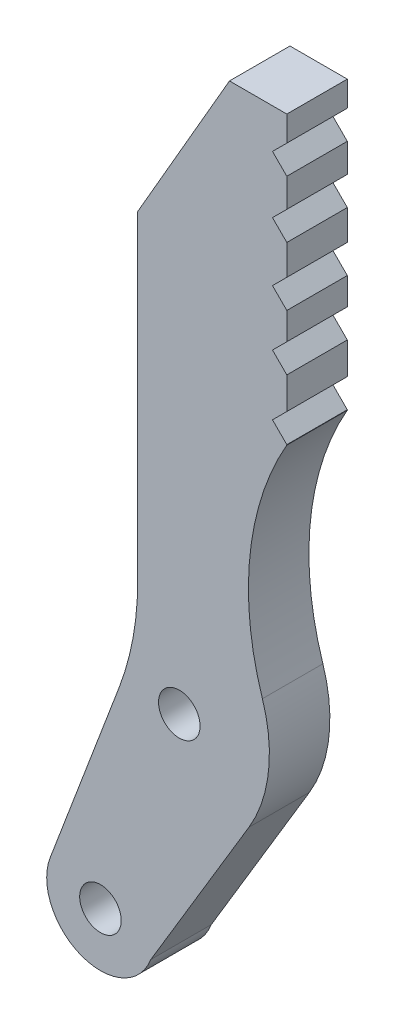
from build123d import *

# Parameters (mm, degrees)
BOSS_EXTRUDE1_DEPTH      = 5.08
BOSS_EXTRUDE1_DEPTH_BACK = 0.278409343
SKETCH1_R                = 1.8415
CUT_EXTRUDE1_DEPTH       = 72.358313291
CUT_EXTRUDE1_DEPTH_BACK  = 72.358313291
BOSS_EXTRUDE2_DEPTH      = 0.635
FILLET2_R                = 12.7
CUT_EXTRUDE2_DEPTH       = 72.358313411
CUT_EXTRUDE2_DEPTH_BACK  = 72.358313411
FILLET3_R                = 25.4


with BuildPart() as part:
    # Sketch1 → Boss-Extrude1 (new, two sides: drawn at the far end of the back side and taken through both)
    with BuildSketch(Plane.XY.offset(-BOSS_EXTRUDE1_DEPTH_BACK)):
        with BuildLine():
            Line((-1.208443772, 47.324573258), (-1.208443772, 10.242675014))
            Line((-1.208443772, 10.242675014), (-4.452925719, 1.68904079))
            ThreePointArc((-4.452925719, 1.68904079), (-1.68904079, -4.452925719), (4.452925719, -1.68904079))
            Line((4.452925719, -1.68904079), (16.51, 18.415))
            ThreePointArc((16.51, 18.415), (13.107045256, 31.115), (16.51, 43.815))
            Line((16.51, 43.815), (16.51, 69.215))
            Line((16.51, 69.215), (11.43, 69.215))
            Line((11.43, 69.215), (-1.208443772, 47.324573258))
        make_face()
        Circle(SKETCH1_R, mode=Mode.SUBTRACT)
        with Locations((6.985, 18.415)):
            Circle(SKETCH1_R, mode=Mode.SUBTRACT)
    extrude(amount=BOSS_EXTRUDE1_DEPTH + BOSS_EXTRUDE1_DEPTH_BACK)

    # Sketch2 → Cut-Extrude1 (cut, two sides: drawn at the far end of the back side and taken through both)
    with BuildSketch(Plane(origin=(0, 0, -0.278409343), x_dir=(-1, 0, 0), z_dir=(0, 0, -1)).offset(-CUT_EXTRUDE1_DEPTH_BACK)):
        Polygon((-16.51, 64.442139164), (-15.24, 65.712139164), (-16.51, 66.982139164), align=None)
        Polygon((-16.51, 61.902139164), (-16.51, 59.362139164), (-15.24, 60.632139164), align=None)
        Polygon((-15.24, 55.415909985), (-16.51, 56.685909985), (-16.51, 54.145909985), align=None)
        Polygon((-16.51, 49.202139164), (-15.24, 50.472139164), (-16.51, 51.742139164), align=None)
        Polygon((-16.51, 43.849680806), (-15.24, 45.119680806), (-16.51, 46.389680806), align=None)
    extrude(amount=CUT_EXTRUDE1_DEPTH + CUT_EXTRUDE1_DEPTH_BACK, mode=Mode.SUBTRACT)

    # Sketch5 → Boss-Extrude2 (add)
    # profile 1 of 5: a face of its own
    with BuildSketch(Plane(origin=(0, 0, -0.278409343), x_dir=(-1, 0, 0), z_dir=(0, 0, -1))):
        Polygon((-11.43, 49.268745692), (-11.43, 50.883373857), (-9.418496835, 52.375422908), (-9.795276899, 52.676846958), (-11.43, 52.676846958), (-11.43, 53.962922908), (-6.35, 53.962922908), (-6.35, 52.676846958), (-8.660917722, 52.676846958), (-6.35, 50.897440313), (-6.35, 49.397353287), (-8.701107595, 51.338524173), align=None)
    # profile 2 of 5: a face of its own
    with BuildSketch(Plane(origin=(0, 0, -0.278409343), x_dir=(-1, 0, 0), z_dir=(0, 0, -1))):
        Polygon((-11.43, 43.931530503), (-11.43, 45.303009933), (-10.401139241, 45.658690313), (-10.401139241, 47.54560487), (-11.43, 47.901285249), (-11.43, 49.204441895), (-6.35, 47.323555819), (-6.35, 45.812416579), align=None)
        Polygon((-9.500886076, 45.963128604), (-7.647128165, 46.602147591), (-9.500886076, 47.241166579), align=None, mode=Mode.SUBTRACT)
    # profile 3 of 5: a face of its own
    with BuildSketch(Plane(origin=(0, 0, -0.278409343), x_dir=(-1, 0, 0), z_dir=(0, 0, -1))):
        with BuildLine():
            add(Edge.make_bspline(
                [(-7.945537975, 39.044441895), (-8.001893228, 39.045595729), (-8.114416057, 39.047899554), (-8.28200483, 39.072775037), (-8.447950006, 39.109194211), (-8.609957002, 39.161582728), (-8.764806034, 39.226372615), (-8.907675176, 39.307175215), (-9.039325299, 39.398356472), (-9.116222705, 39.470801449), (-9.154248418, 39.506625439)],
                knots=[0, 0, 0, 0, 1.018976149, 2.03455883, 3.059303171, 4.090371279, 5.111291766, 6.090739543, 7.055872052, 8, 8, 8, 8], degree=3))
            add(Edge.make_bspline(
                [(-9.154248418, 39.506625439), (-9.201805939, 39.55801623), (-9.296070219, 39.659878477), (-9.418570971, 39.826256442), (-9.522735706, 40.00129059), (-9.610286921, 40.186696086), (-9.676976835, 40.389424255), (-9.724895215, 40.612612286), (-9.752324851, 40.858668471), (-9.756124843, 41.030087139), (-9.758101266, 41.11924411)],
                knots=[0, 0, 0, 0, 0.948117162, 1.879273337, 2.792894651, 3.704383692, 4.651446974, 5.677657949, 6.792121143, 8, 8, 8, 8], degree=3))
            Line((-9.758101266, 41.11924411), (-9.758101266, 41.938112781))
            Line((-9.758101266, 41.938112781), (-11.43, 41.938112781))
            Line((-11.43, 41.938112781), (-11.43, 43.22418873))
            Line((-11.43, 43.22418873), (-6.35, 43.22418873))
            Line((-6.35, 43.22418873), (-6.35, 41.075035249))
            add(Edge.make_bspline(
                [(-6.35, 41.075035249), (-6.350776756, 40.997637205), (-6.35226824, 40.849021858), (-6.368729674, 40.63535844), (-6.394065089, 40.440645282), (-6.429937183, 40.263077028), (-6.478568776, 40.100769403), (-6.533724195, 39.948050161), (-6.602528473, 39.805953028), (-6.656105267, 39.717237318), (-6.682571203, 39.673413414)],
                knots=[0, 0, 0, 0, 1.27106079, 2.440619017, 3.517381815, 4.494852357, 5.412224011, 6.298180721, 7.159333057, 8, 8, 8, 8], degree=3))
            add(Edge.make_bspline(
                [(-6.682571203, 39.673413414), (-6.716741123, 39.624441403), (-6.784307056, 39.527606537), (-6.908159272, 39.40226874), (-7.043131438, 39.291772761), (-7.194439682, 39.202199788), (-7.360207545, 39.131182806), (-7.541414973, 39.079940069), (-7.738556134, 39.049817137), (-7.875098439, 39.046271184), (-7.945537975, 39.044441895)],
                knots=[0, 0, 0, 0, 0.969589194, 1.917218374, 2.854679868, 3.800052037, 4.766330684, 5.780154268, 6.854824506, 8, 8, 8, 8], degree=3))
        make_face()
        with BuildLine():
            add(Edge.make_bspline(
                [(-7.980704114, 40.394821642), (-7.94708576, 40.396040367), (-7.881091423, 40.398432779), (-7.786293373, 40.42106559), (-7.698560794, 40.457900068), (-7.620028501, 40.509101182), (-7.551714372, 40.570364624), (-7.492559182, 40.636019652), (-7.443946978, 40.706545052), (-7.421922651, 40.758113612), (-7.411012658, 40.783658667)],
                knots=[0, 0, 0, 0, 1.099448196, 2.158266167, 3.170681306, 4.20198982, 5.212085426, 6.167530276, 7.092265935, 8, 8, 8, 8], degree=3))
            add(Edge.make_bspline(
                [(-7.411012658, 40.783658667), (-7.398681248, 40.817631613), (-7.374423802, 40.884460703), (-7.349009707, 40.986535287), (-7.329727426, 41.086742841), (-7.322884819, 41.189157588), (-7.319312234, 41.298731496), (-7.315930195, 41.421655598), (-7.315672903, 41.560999172), (-7.314943057, 41.659128638), (-7.314556962, 41.711039996)],
                knots=[0, 0, 0, 0, 0.923484003, 1.816610051, 2.686736138, 3.528764097, 4.437155579, 5.490796045, 6.672608819, 8, 8, 8, 8], degree=3))
            Line((-7.314556962, 41.711039996), (-7.314556962, 41.938112781))
            Line((-7.314556962, 41.938112781), (-8.793544304, 41.938112781))
            Line((-8.793544304, 41.938112781), (-8.793544304, 41.559323224))
            add(Edge.make_bspline(
                [(-8.793544304, 41.559323224), (-8.793416885, 41.505386209), (-8.793174545, 41.402802255), (-8.784393416, 41.256060304), (-8.773143564, 41.124216394), (-8.756507529, 41.005510708), (-8.732152805, 40.898637133), (-8.695984985, 40.802354267), (-8.652914661, 40.713226884), (-8.613902833, 40.661532903), (-8.59460443, 40.635960882)],
                knots=[0, 0, 0, 0, 1.344391089, 2.556925957, 3.663619572, 4.642520217, 5.543736864, 6.38907055, 7.203104098, 8, 8, 8, 8], degree=3))
            add(Edge.make_bspline(
                [(-8.59460443, 40.635960882), (-8.57631846, 40.615730536), (-8.540475406, 40.576076235), (-8.478983071, 40.52504715), (-8.412749808, 40.483066813), (-8.340873581, 40.448470473), (-8.261518495, 40.425677511), (-8.175411224, 40.406665169), (-8.080697555, 40.397552624), (-8.014877557, 40.395754974), (-7.980704114, 40.394821642)],
                knots=[0, 0, 0, 0, 0.95676139, 1.87538582, 2.79551496, 3.705743042, 4.665608113, 5.687530201, 6.799376242, 8, 8, 8, 8], degree=3))
        make_face(mode=Mode.SUBTRACT)
    # profile 4 of 5: a face of its own
    with BuildSketch(Plane(origin=(0, 0, -0.278409343), x_dir=(-1, 0, 0), z_dir=(0, 0, -1))):
        Polygon((-7.314556962, 34.157353287), (-7.314556962, 35.764948224), (-11.43, 35.764948224), (-11.43, 37.051024173), (-7.314556962, 37.051024173), (-7.314556962, 38.65861911), (-6.35, 38.65861911), (-6.35, 34.157353287), align=None)
    # profile 5 of 5: a face of its own
    with BuildSketch(Plane(origin=(0, 0, -0.278409343), x_dir=(-1, 0, 0), z_dir=(0, 0, -1))):
        Polygon((-11.43, 28.691530503), (-11.43, 30.063009933), (-10.401139241, 30.418690313), (-10.401139241, 32.30560487), (-11.43, 32.661285249), (-11.43, 33.964441895), (-6.35, 32.083555819), (-6.35, 30.572416579), align=None)
        Polygon((-9.500886076, 30.723128604), (-7.647128165, 31.362147591), (-9.500886076, 32.001166579), align=None, mode=Mode.SUBTRACT)
    extrude(amount=BOSS_EXTRUDE2_DEPTH)

    # Fillet2
    fillet2_edges = [part.edges().sort_by_distance(p)[0] for p in [
        (16.51, 18.415, 2.400795328),
        (-1.208443772, 10.242675014, 2.400795328),
    ]]
    fillet(fillet2_edges, radius=FILLET2_R)

    # Sketch6 → Cut-Extrude2 (cut, two sides: drawn at the far end of the back side and taken through both)
    with BuildSketch(Plane(origin=(0, 0, -0.278409343), x_dir=(-1, 0, 0), z_dir=(0, 0, -1)).offset(-CUT_EXTRUDE2_DEPTH_BACK)):
        Polygon((-3.302, 55.136891036), (1.856635391, 55.136891036), (1.856635391, 24.765), (12.813790146, 19.47273461), (4.452925719, 1.68904079), (-2.532074281, 20.10404079), (-3.302, 22.133844959), align=None)
    extrude(amount=CUT_EXTRUDE2_DEPTH + CUT_EXTRUDE2_DEPTH_BACK, mode=Mode.SUBTRACT)

    # Fillet3
    fillet3_edges = [part.edges().sort_by_distance(p)[0] for p in [
        (3.302, 22.133844959, 2.400795328),
    ]]
    fillet(fillet3_edges, radius=FILLET3_R)


solid = part.part
